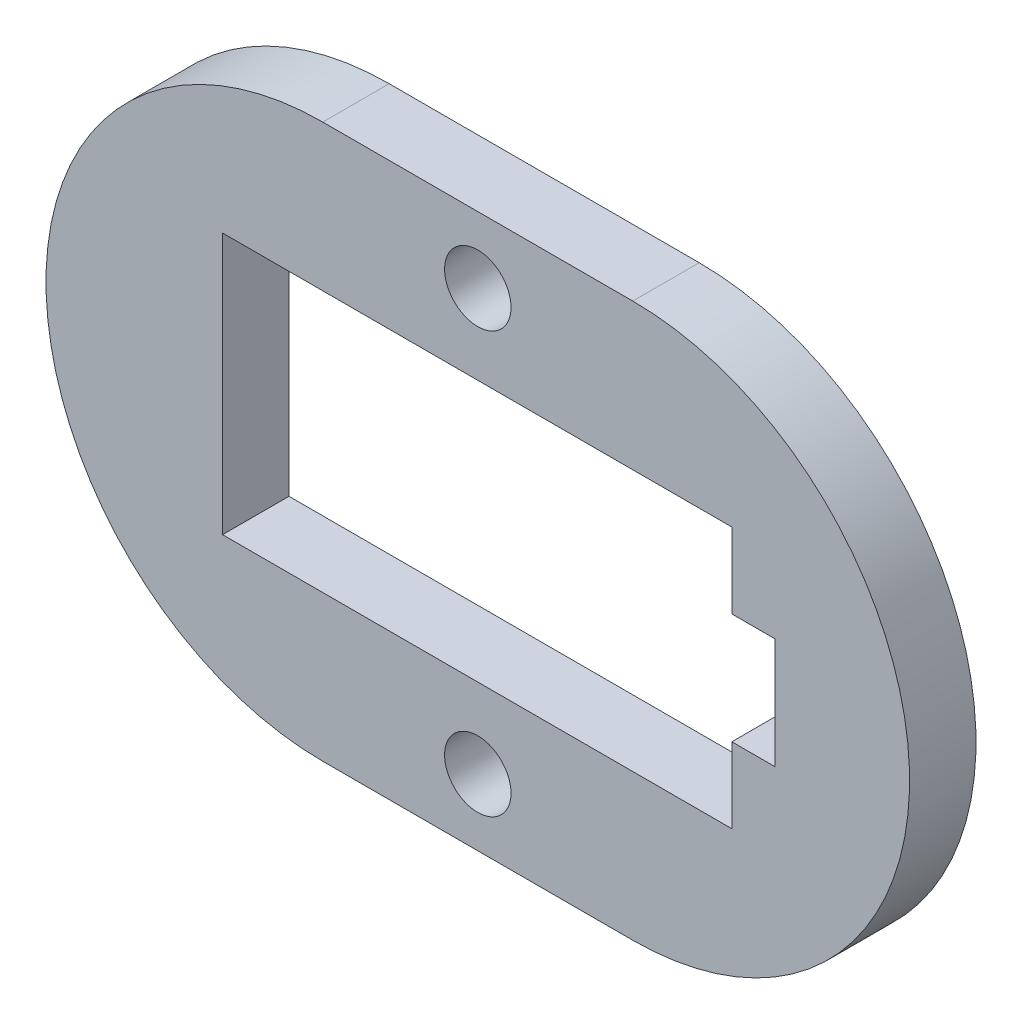
from build123d import *

# Parameters (mm, degrees)
ESQUISSE2_R        = 1.5
BOSS_EXTRU_2_DEPTH = 3


with BuildPart() as part:
    # Esquisse2 → Boss.-Extru.2 (new body)
    with BuildSketch(Plane.XY):
        with BuildLine():
            Line((4.526650681, 18.4), (18.526650681, 18.4))
            ThreePointArc((18.526650681, 18.4), (31.026650681, 5.9), (18.526650681, -6.6))
            Line((18.526650681, -6.6), (4.526650681, -6.6))
            ThreePointArc((4.526650681, -6.6), (-7.973349319, 5.9), (4.526650681, 18.4))
        make_face()
        with Locations((11.526650681, 15.4)):
            Circle(ESQUISSE2_R, mode=Mode.SUBTRACT)
        with Locations((11.526650681, -3.6)):
            Circle(ESQUISSE2_R, mode=Mode.SUBTRACT)
        Polygon((0, 0), (0, 11.8), (23, 11.8), (23, 8.4), (24.940257674, 8.4), (24.940257674, 3.4), (23, 3.4), (23, 0), align=None, mode=Mode.SUBTRACT)
    extrude(amount=BOSS_EXTRU_2_DEPTH)


solid = part.part
